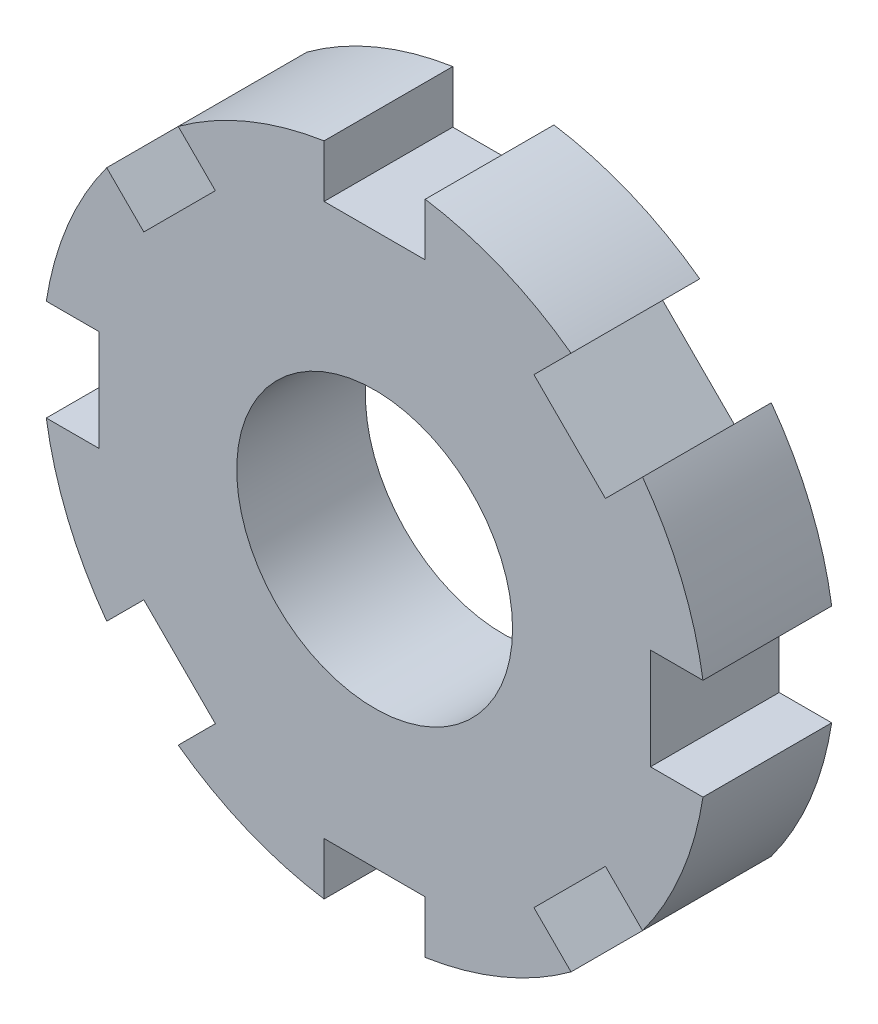
from build123d import *

# Parameters (mm, degrees)
BOSS_EXTRU_1_DEPTH           = 14
ENL_V_MAT_EXTRU_1_DEPTH      = 89.577649551
ENL_V_MAT_EXTRU_1_DEPTH_BACK = 89.577649551
ESQUISSE2_R                  = 15
ESQUISSE3_R                  = 45.33486517
ESQUISSE3_R_2                = 36.129973706
ENL_V_MAT_EXTRU_2_DEPTH      = 89.577649551


with BuildPart() as part:
    # Esquisse1 → Boss.-Extru.1 (new body)
    with BuildSketch(Plane.XY):
        Polygon((-5.5, 0), (5.5, 0), (5.5, -15), (21.360912703, 0.860912703), (17.324116139, 4.897709268), (25.102290732, 12.675883861), (29.139087297, 8.639087297), (45, 24.5), (30, 24.5), (30, 35.5), (45, 35.5), (29.139087297, 51.360912703), (25.102290732, 47.324116139), (17.324116139, 55.102290732), (21.360912703, 59.139087297), (5.5, 75), (5.5, 60), (-5.5, 60), (-5.5, 75), (-21.360912703, 59.139087297), (-17.324116139, 55.102290732), (-25.102290732, 47.324116139), (-29.139087297, 51.360912703), (-45, 35.5), (-30, 35.5), (-30, 24.5), (-45, 24.5), (-29.139087297, 8.639087297), (-25.102290732, 12.675883861), (-17.324116139, 4.897709268), (-21.360912703, 0.860912703), (-5.5, -15), align=None)
    extrude(amount=BOSS_EXTRU_1_DEPTH)

    # Esquisse2 → Enlèv. mat.-Extru.1 (cut, two sides: drawn at the far end of the back side and taken through both)
    with BuildSketch(Plane.XY.offset(14).offset(-ENL_V_MAT_EXTRU_1_DEPTH_BACK)):
        with Locations((0, 30)):
            Circle(ESQUISSE2_R)
    extrude(amount=ENL_V_MAT_EXTRU_1_DEPTH + ENL_V_MAT_EXTRU_1_DEPTH_BACK, mode=Mode.SUBTRACT)

    # Esquisse3 → Enlèv. mat.-Extru.2 (cut, through all)
    with BuildSketch(Plane.XY.offset(14)):
        with Locations((0, 30)):
            Circle(ESQUISSE3_R)
        with Locations((0, 30)):
            Circle(ESQUISSE3_R_2, mode=Mode.SUBTRACT)
    extrude(amount=-ENL_V_MAT_EXTRU_2_DEPTH, mode=Mode.SUBTRACT)


solid = part.part
